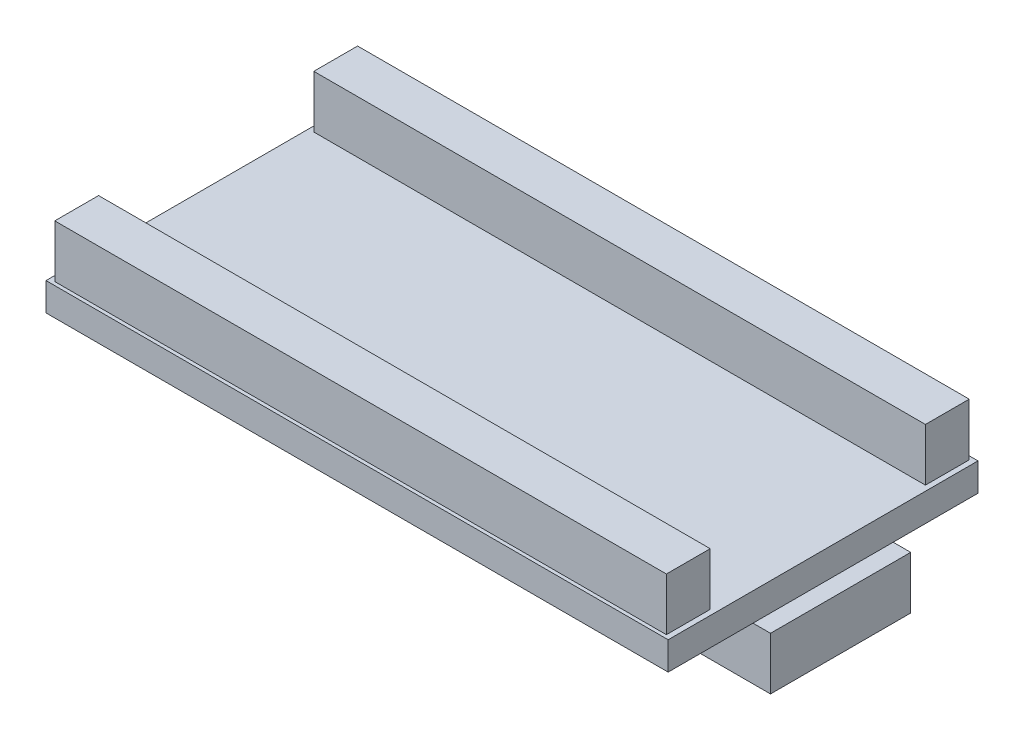
from build123d import *

# Parameters (mm, degrees)
SKETCH1_W           = 35.5
SKETCH1_H           = 17.68
BOSS_EXTRUDE1_DEPTH = 1.6
SKETCH2_W           = 34.9
SKETCH2_H           = 2.5
BOSS_EXTRUDE2_DEPTH = 3
SKETCH3_W           = 5.6
SKETCH3_H           = 8
BOSS_EXTRUDE3_DEPTH = 3


with BuildPart() as part:
    # Sketch1 → Boss-Extrude1 (new body)
    with BuildSketch(Plane(origin=(0, 0, 0), x_dir=(1, 0, 0), z_dir=(0, 1, 0))):
        Rectangle(SKETCH1_W, SKETCH1_H)
    extrude(amount=BOSS_EXTRUDE1_DEPTH)

    # Sketch2 → Boss-Extrude2 (add)
    with BuildSketch(Plane(origin=(0, 1.6, 0), x_dir=(1, 0, 0), z_dir=(0, 1, 0))):
        with Locations((0, 7.39)):
            Rectangle(SKETCH2_W, SKETCH2_H)
        with Locations((0, -7.39)):
            Rectangle(SKETCH2_W, SKETCH2_H)
    extrude(amount=BOSS_EXTRUDE2_DEPTH)

    # Sketch3 → Boss-Extrude3 (add)
    with BuildSketch(Plane.XZ):
        with Locations((15.95, 0)):
            Rectangle(SKETCH3_W, SKETCH3_H)
    extrude(amount=BOSS_EXTRUDE3_DEPTH)


solid = part.part
